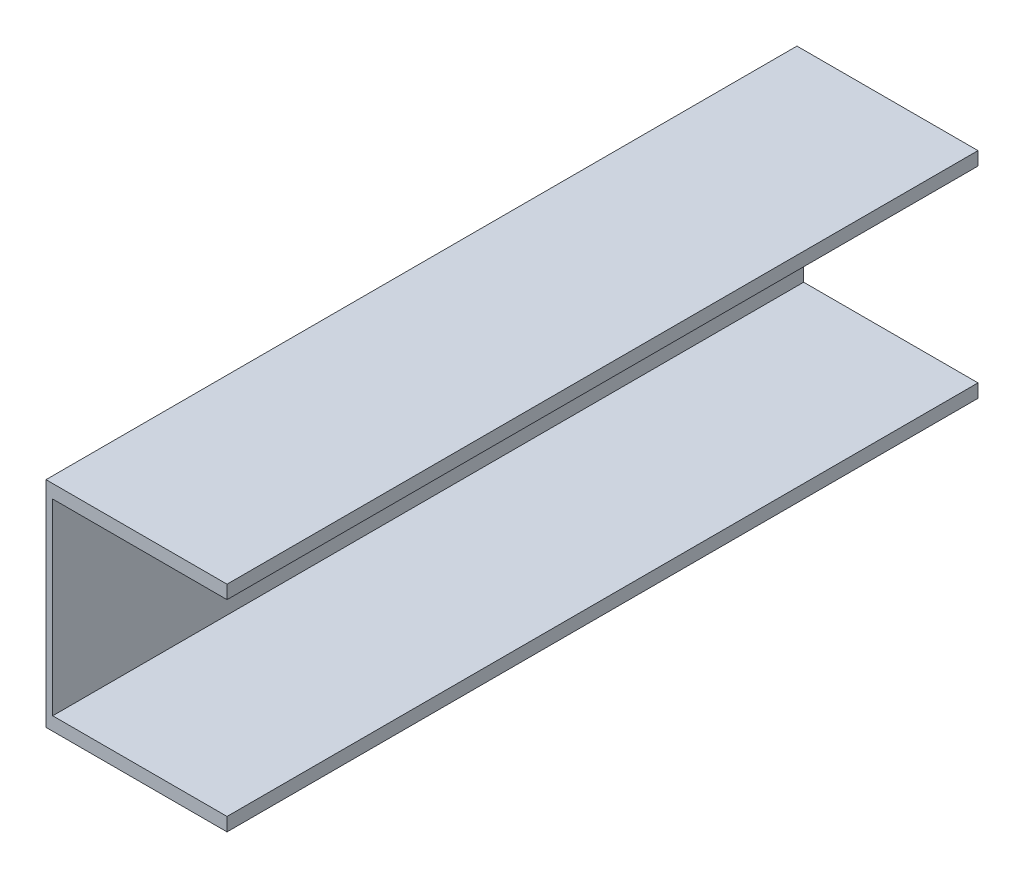
from build123d import *

# Parameters (mm, degrees)
SKETCH1_W           = 355.6
SKETCH1_H           = 101.6
BOSS_EXTRUDE1_DEPTH = 3.175
SKETCH2_W           = 355.6
SKETCH2_H           = 6.35
BOSS_EXTRUDE2_DEPTH = 82.55


with BuildPart() as part:
    # Sketch1 → Boss-Extrude1 (new body)
    with BuildSketch(Plane(origin=(0, 0, 0), x_dir=(0, 0, -1), z_dir=(1, 0, 0))):
        with Locations((177.8, 50.8)):
            Rectangle(SKETCH1_W, SKETCH1_H)
    extrude(amount=BOSS_EXTRUDE1_DEPTH)

    # Sketch2 → Boss-Extrude2 (add)
    with BuildSketch(Plane(origin=(3.175, 0, 0), x_dir=(0, 0, -1), z_dir=(1, 0, 0))):
        with Locations((177.8, 3.175)):
            Rectangle(SKETCH2_W, SKETCH2_H)
        with Locations((177.8, 98.425)):
            Rectangle(SKETCH2_W, SKETCH2_H)
    extrude(amount=BOSS_EXTRUDE2_DEPTH)


solid = part.part
